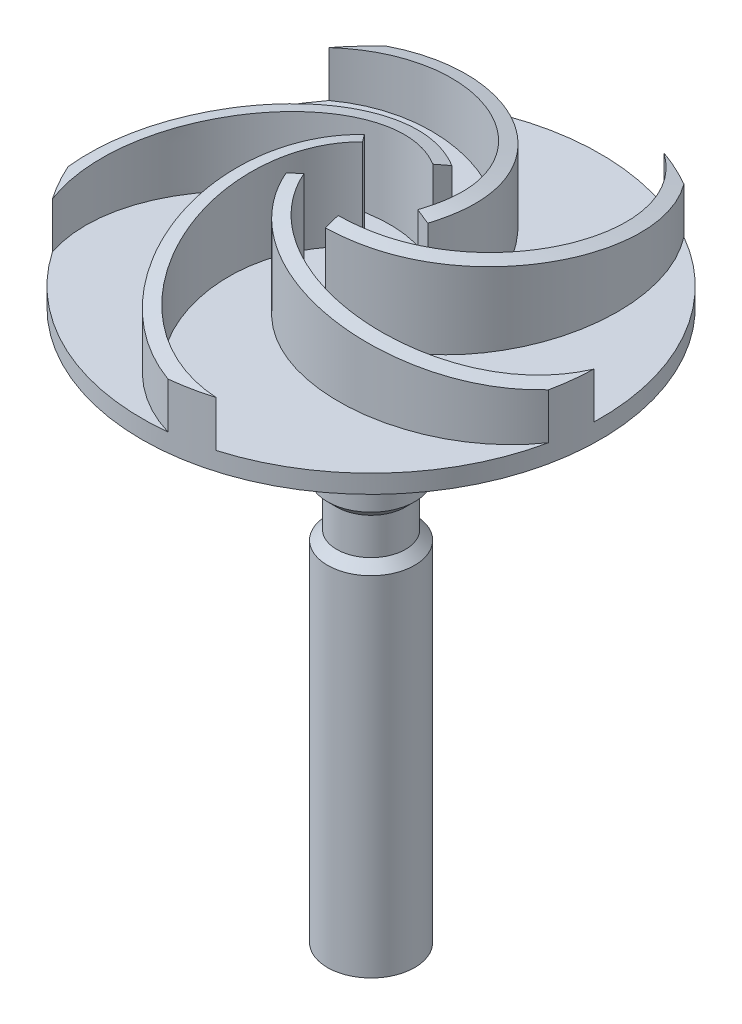
from build123d import *
from build123d.topology import SkipClean

# Parameters (mm, degrees)
SKETCH1_R           = 25
BOSS_EXTRUDE1_DEPTH = 2
BOSS_EXTRUDE3_DEPTH = 11
CIRPATTERN2_COUNT   = 5
SKETCH8_R           = 4.75
BOSS_EXTRUDE4_DEPTH = 60


with BuildPart() as part:
    # Sketch1 → Boss-Extrude1 (new body)
    with BuildSketch(Plane(origin=(0, 0, 0), x_dir=(1, 0, 0), z_dir=(0, 1, 0))):
        with Locations(Location((0, 0, 0), (0, 0, 270))):
            Circle(SKETCH1_R)
    extrude(amount=BOSS_EXTRUDE1_DEPTH)

    # Sketch6 → Boss-Extrude3 (add)
    with SkipClean():  # the faces are left unmerged after this step: merging them gives an invalid solid
        with BuildSketch(Plane(origin=(0, 2, 0), x_dir=(1, 0, 0), z_dir=(0, 1, 0))):
            with BuildLine():
                Line((-5.749328812, -3.514472379), (-4.357862857, -2.954273756))
                add(Edge.make_bspline(
                    [(24.990911261, -0.6740581), (24.887127665, -0.995867182), (24.628566718, -1.71005287), (23.985595049, -3.118765197), (22.927284176, -4.807175828), (21.362285482, -6.562232424), (18.938714489, -8.542099357), (15.390420708, -10.325722821), (10.688001964, -11.310980176), (5.945767318, -11.102441479), (2.299064528, -9.918635861), (-0.243718056, -8.363779173), (-1.919950701, -6.893472831), (-3.091637326, -5.406975724), (-3.870057013, -4.063909627), (-4.208200766, -3.326016377), (-4.357862857, -2.954273756)],
                    knots=[0.005993496, 0.005993496, 0.005993496, 0.005993496, 0.03125, 0.0625, 0.125, 0.1875, 0.25, 0.375, 0.5, 0.625, 0.75, 0.8125, 0.875, 0.9375, 0.96875, 1, 1, 1, 1], degree=3))
                ThreePointArc((24.990911261, -0.6740581), (24.830643284, -2.905022217), (24.471615475, -5.112732739))
                add(Edge.make_bspline(
                    [(24.471615475, -5.112732739), (24.344067288, -5.299138073), (23.703665176, -6.193036835), (22.402205392, -7.651941384), (19.740962464, -9.824635663), (15.884154507, -11.759601207), (10.813494683, -12.820990147), (5.68777112, -12.598238156), (1.692234731, -11.306666743), (-1.134460197, -9.57992313), (-3.013339021, -7.932747167), (-4.331263311, -6.260928308), (-5.204824167, -4.753175927), (-5.582097267, -3.929855409), (-5.749328812, -3.514472379)],
                    knots=[0.10889818, 0.10889818, 0.10889818, 0.10889818, 0.125, 0.1875, 0.25, 0.375, 0.5, 0.625, 0.75, 0.8125, 0.875, 0.9375, 0.96875, 1, 1, 1, 1], degree=3))
            make_face()
        boss_extrude3 = extrude(amount=BOSS_EXTRUDE3_DEPTH)

    # CirPattern2: Boss-Extrude3 ×5 about axis
    with SkipClean():  # the faces are left unmerged after this step: merging them gives an invalid solid
        cirpattern2_axis = Axis((0, 0, 0), (0, 1, 0))
        for i in range(1, CIRPATTERN2_COUNT):
            add(boss_extrude3.rotate(cirpattern2_axis, i * 360 / CIRPATTERN2_COUNT))

    # Sketch7 → Cut-Revolve7 (revolve, cut)
    with SkipClean():  # the faces are left unmerged after this step: merging them gives an invalid solid
        with BuildSketch(Plane(origin=(0, 0, 0), x_dir=(0, 0, -1), z_dir=(1, 0, 0)), mode=Mode.PRIVATE) as cut_revolve7_sk:
            Polygon((25, 7), (25, 13), (1, 13), align=None)
        revolve(cut_revolve7_sk.sketch.rotate(Axis((0, 0, 0), (0, 1, 0)), 340.454985394), axis=Axis((0, 0, 0), (0, 1, 0)), mode=Mode.SUBTRACT)

    # Sketch8 → Boss-Extrude4 (add)
    with SkipClean():  # the faces are left unmerged after this step: merging them gives an invalid solid
        with BuildSketch(Plane.XZ):
            with Locations(Location((0, 0, 0), (0, 0, 270))):
                Circle(SKETCH8_R)
        extrude(amount=BOSS_EXTRUDE4_DEPTH)

    # Sketch9 → Cut-Revolve8 (revolve, cut)
    with SkipClean():  # the faces are left unmerged after this step: merging them gives an invalid solid
        with BuildSketch(Plane.XY, mode=Mode.PRIVATE) as cut_revolve8_sk:
            Polygon((-4.75, -16), (-3.75, -17), (-3.75, -21), (-4.75, -22), align=None)
        revolve(cut_revolve8_sk.sketch.rotate(Axis((0, 0, 0), (0, -1, 0)), 270), axis=Axis((0, 0, 0), (0, -1, 0)), mode=Mode.SUBTRACT)


solid = part.part
